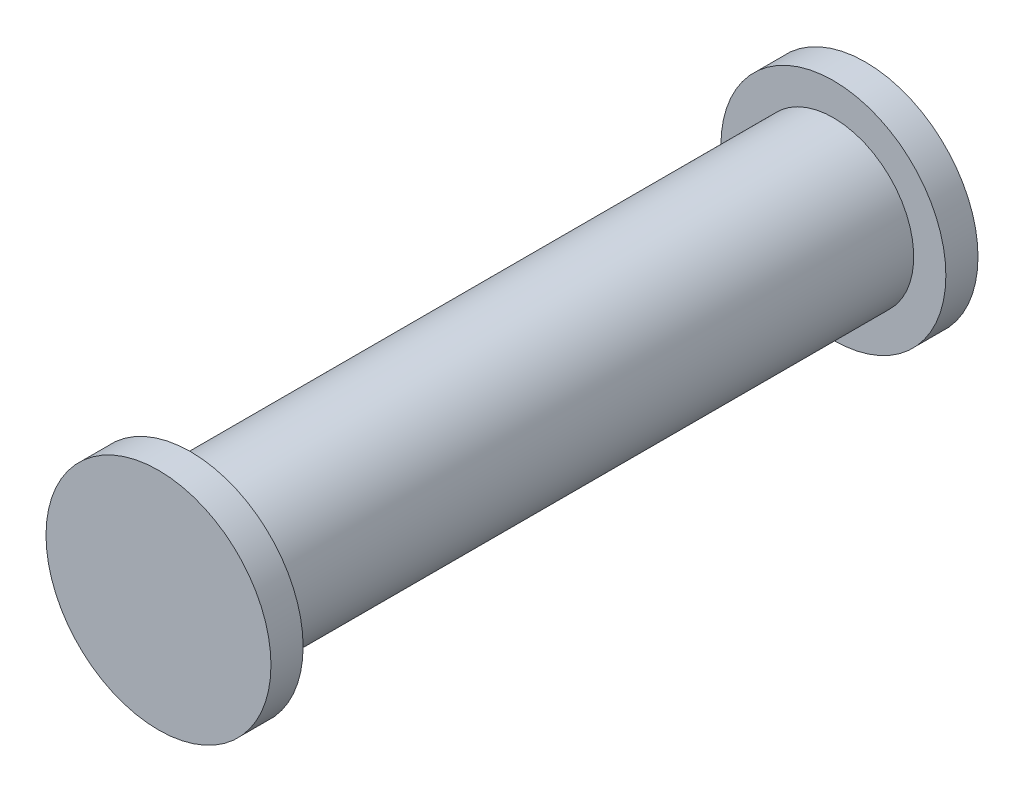
from build123d import *

# Parameters (mm, degrees)
SKETCH1_R           = 12.5
BOSS_EXTRUDE1_DEPTH = 100
SKETCH2_R           = 17.5
BOSS_EXTRUDE2_DEPTH = 5
BOSS_EXTRUDE3_START = 5
SKETCH3_R           = 17.5
BOSS_EXTRUDE3_DEPTH = 5


with BuildPart() as part:
    # Sketch1 → Boss-Extrude1 (new body)
    with BuildSketch(Plane.XY):
        Circle(SKETCH1_R)
    extrude(amount=BOSS_EXTRUDE1_DEPTH)

    # Sketch2 → Boss-Extrude2 (add)
    with BuildSketch(Plane.XY.offset(100)):
        Circle(SKETCH2_R)
    extrude(amount=BOSS_EXTRUDE2_DEPTH)

    # Sketch3 → Boss-Extrude3 (add)
    with BuildSketch(Plane(origin=(0, 0, 0), x_dir=(-1, 0, 0), z_dir=(0, 0, -1)).offset(BOSS_EXTRUDE3_START)):
        with Locations(Location((0, 0, 0), (0, 0, 180))):
            Circle(SKETCH3_R)
    extrude(amount=-BOSS_EXTRUDE3_DEPTH)


solid = part.part
